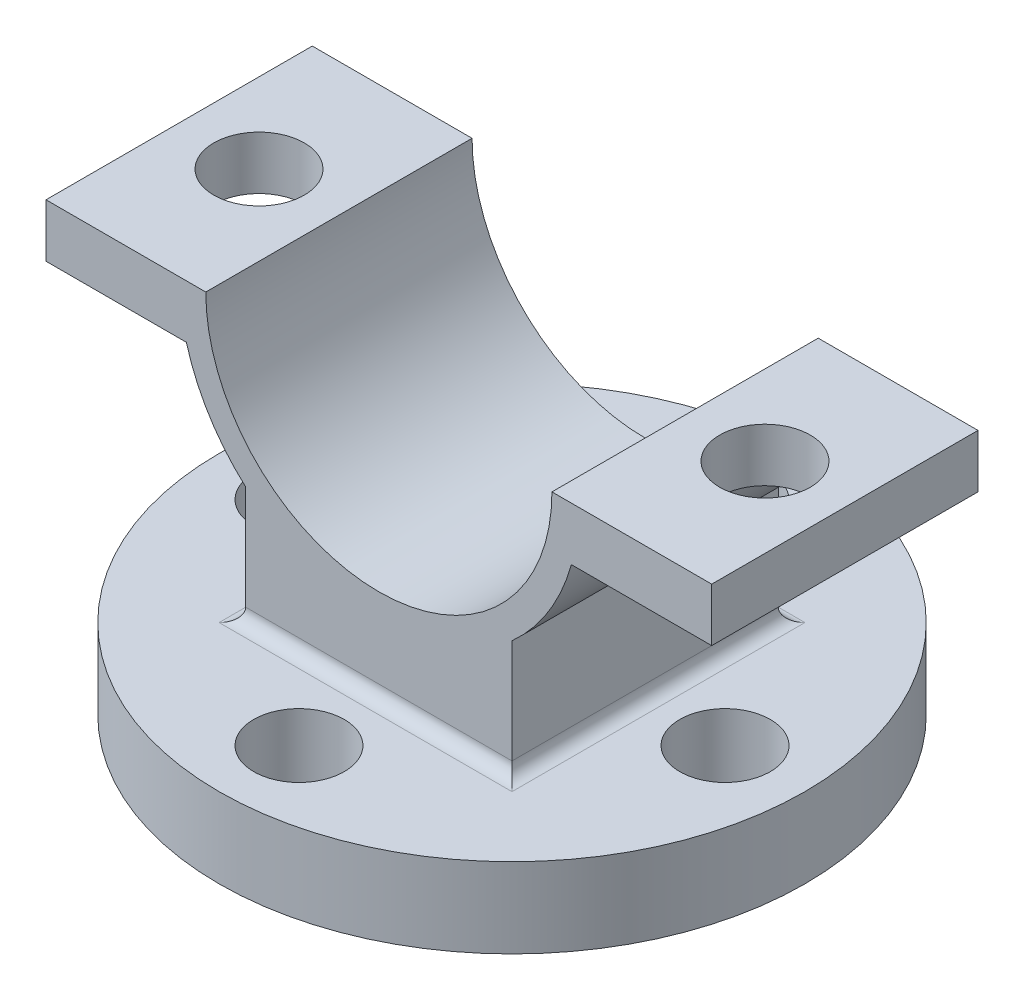
from build123d import *

# Parameters (mm, degrees)
EXTRUDE_1_DEPTH     = 5
SKETCH_2_R          = 11
EXTRUDE_2_DEPTH     = 3
SKETCH_3_R          = 1.7
CUT_EXTRUDE_1_DEPTH = 3
FILLET_1_R          = 0.5
CUT_EXTRUDE_2_REACH = 23.125
SKETCH_4_R          = 1.7


with BuildPart() as part:
    # 草图1 → 凸台-拉伸1 (new, symmetric)
    with BuildSketch(Plane.XY):
        with BuildLine():
            Line((5, 0), (-5, 0))
            Line((-5, 0), (-5, 4.409830056))
            ThreePointArc((-5, 4.409830056), (-6.372273568, 6.044733944), (-7.228416147, 8))
            Line((-7.228416147, 8), (-12.5, 8))
            Line((-12.5, 8), (-12.5, 10))
            Line((-12.5, 10), (-6.5, 10))
            ThreePointArc((-6.5, 10), (0, 3.5), (6.5, 10))
            Line((6.5, 10), (12.5, 10))
            Line((12.5, 10), (12.5, 8))
            Line((12.5, 8), (7.228416147, 8))
            ThreePointArc((7.228416147, 8), (6.372273568, 6.044733944), (5, 4.409830056))
            Line((5, 4.409830056), (5, 0))
        make_face()
    extrude(amount=EXTRUDE_1_DEPTH, both=True)

    # 草图2 → 凸台-拉伸2 (add)
    with BuildSketch(Plane.XZ):
        with Locations(Location((0, 0, 0), (0, 0, 270))):
            Circle(SKETCH_2_R)
    extrude(amount=EXTRUDE_2_DEPTH)

    # 草图3 → 切除-拉伸1 (cut)
    with BuildSketch(Plane.XZ.offset(3)):
        with Locations(Location((0, 8, 0), (0, 0, 270))):
            Circle(SKETCH_3_R)
        with Locations(Location((8, 0, 0), (0, 0, 270))):
            Circle(SKETCH_3_R)
        with Locations(Location((0, -8, 0), (0, 0, 270))):
            Circle(SKETCH_3_R)
        with Locations(Location((-8, 0, 0), (0, 0, 270))):
            Circle(SKETCH_3_R)
    extrude(amount=-CUT_EXTRUDE_1_DEPTH, mode=Mode.SUBTRACT)

    # 圆角1
    fillet_1_edges = [part.edges().sort_by_distance(p)[0] for p in [
        (0, 0, -5),
        (5, 0, 0),
        (-5, 0, 0),
        (0, 0, 5),
    ]]
    fillet(fillet_1_edges, radius=FILLET_1_R)

    # 草图4 → 切除-拉伸2 (cut, up to next)
    with BuildSketch(Plane(origin=(0, 10, 0), x_dir=(1, 0, 0), z_dir=(0, 1, 0)), mode=Mode.PRIVATE) as cut_extrude_2_sk1:
        with Locations(Location((-9.5, 0, 0), (0, 0, 180))):
            Circle(SKETCH_4_R)
    cut_extrude_2_tool1 = extrude(cut_extrude_2_sk1.sketch, amount=-CUT_EXTRUDE_2_REACH, mode=Mode.PRIVATE) & part.part
    # 草图4 → 切除-拉伸2 (cut, up to next)
    with BuildSketch(Plane(origin=(0, 10, 0), x_dir=(1, 0, 0), z_dir=(0, 1, 0)), mode=Mode.PRIVATE) as cut_extrude_2_sk2:
        with Locations(Location((9.5, 0, 0), (0, 0, 270))):
            Circle(SKETCH_4_R)
    cut_extrude_2_tool2 = extrude(cut_extrude_2_sk2.sketch, amount=-CUT_EXTRUDE_2_REACH, mode=Mode.PRIVATE) & part.part
    add(cut_extrude_2_tool1.solids().sort_by_distance((-9.5, 10, 0))[0], mode=Mode.SUBTRACT)
    add(cut_extrude_2_tool2.solids().sort_by_distance((9.5, 10, 0))[0], mode=Mode.SUBTRACT)


solid = part.part
